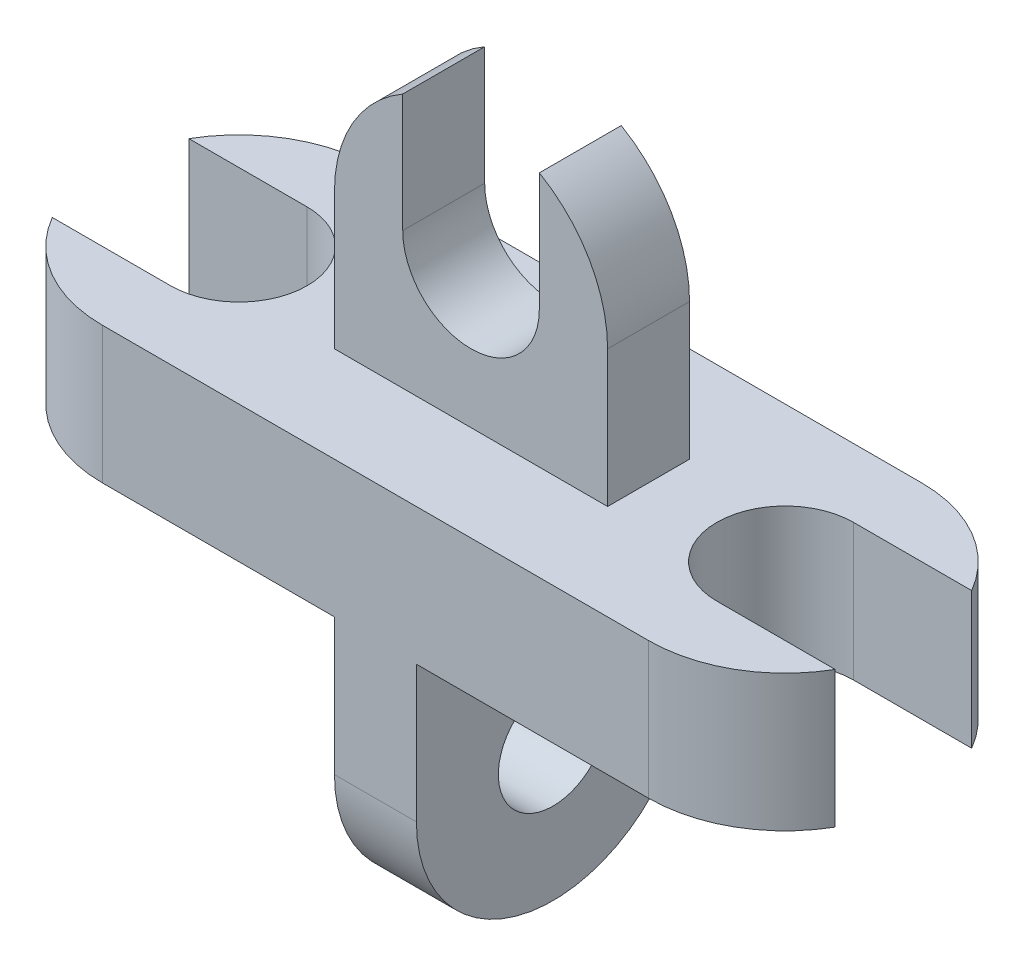
from build123d import *

# Parameters (mm, degrees)
BOSS_EXTRUDE1_DEPTH = 25
BOSS_EXTRUDE2_DEPTH = 15
SKETCH3_R           = 20
BOSS_EXTRUDE3_DEPTH = 15


with BuildPart() as part:
    # Sketch1 → Boss-Extrude1 (new, symmetric)
    with BuildSketch(Plane(origin=(0, 0, 0), x_dir=(1, 0, 0), z_dir=(0, 1, 0))):
        with BuildLine():
            Line((100, -50), (-100, -50))
            ThreePointArc((-100, -50), (-125, -43.301270189), (-143.301270189, -25))
            Line((-143.301270189, -25), (-100, -25))
            ThreePointArc((-100, -25), (-75, 0), (-100, 25))
            Line((-100, 25), (-143.301270189, 25))
            ThreePointArc((-143.301270189, 25), (-125, 43.301270189), (-100, 50))
            Line((-100, 50), (100, 50))
            ThreePointArc((100, 50), (125, 43.301270189), (143.301270189, 25))
            Line((143.301270189, 25), (100, 25))
            ThreePointArc((100, 25), (75, 0), (100, -25))
            Line((100, -25), (143.301270189, -25))
            ThreePointArc((143.301270189, -25), (125, -43.301270189), (100, -50))
        make_face()
    extrude(amount=BOSS_EXTRUDE1_DEPTH, both=True)

    # Sketch2 → Boss-Extrude2 (add, symmetric)
    with BuildSketch(Plane.XY):
        with BuildLine():
            Line((-50, 75), (-50, 25))
            Line((-50, 25), (50, 25))
            Line((50, 25), (50, 75))
            ThreePointArc((50, 75), (43.301270189, 100), (25, 118.301270189))
            Line((25, 118.301270189), (25, 75))
            ThreePointArc((25, 75), (0, 50), (-25, 75))
            Line((-25, 75), (-25, 118.301270189))
            ThreePointArc((-25, 118.301270189), (-43.301270189, 100), (-50, 75))
        make_face()
    extrude(amount=BOSS_EXTRUDE2_DEPTH, both=True)

    # Sketch3 → Boss-Extrude3 (add, symmetric)
    with BuildSketch(Plane(origin=(0, 0, 0), x_dir=(0, 0, -1), z_dir=(1, 0, 0))):
        with BuildLine():
            Line((-50, -75), (-50, -25))
            Line((-50, -25), (50, -25))
            Line((50, -25), (50, -75))
            ThreePointArc((50, -75), (0, -125), (-50, -75))
        make_face()
        with Locations((0, -75)):
            Circle(SKETCH3_R, mode=Mode.SUBTRACT)
    extrude(amount=BOSS_EXTRUDE3_DEPTH, both=True)


solid = part.part
